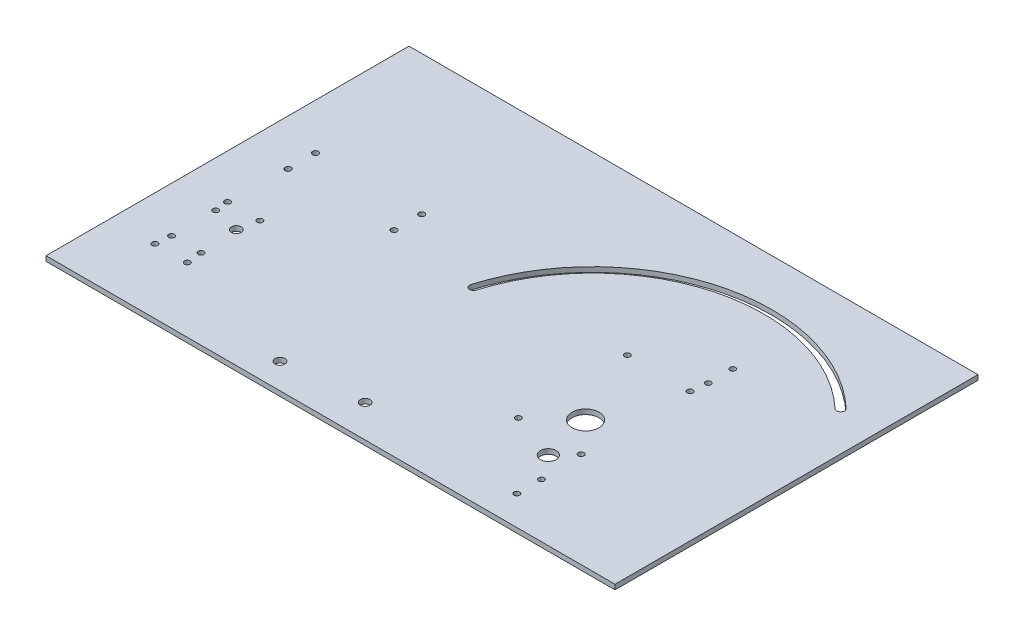
from build123d import *

# Parameters (mm, degrees)
SKETCH1_W           = 317.5
SKETCH1_H           = 177.8
SKETCH1_R           = 3.175
SKETCH1_R_2         = 8.73125
SKETCH1_R_3         = 1.905
BOSS_EXTRUDE1_DEPTH = 3.175
SKETCH3_R           = 3.175
CUT_EXTRUDE2_DEPTH  = 182.974869488
SKETCH4_W           = 25.4
SKETCH4_H           = 177.8
CUT_EXTRUDE3_DEPTH  = 182.974869488
SKETCH5_R           = 5.08
CUT_EXTRUDE4_DEPTH  = 182.974869488
SKETCH6_R           = 1.8034
CUT_EXTRUDE5_DEPTH  = 182.974869488
SKETCH7_R           = 1.8415
CUT_EXTRUDE6_DEPTH  = 182.974869488
BOSS_EXTRUDE2_DEPTH = 3.175
CUT_EXTRUDE7_DEPTH  = 256.444486386


with BuildPart() as part:
    # Sketch1 → Boss-Extrude1 (new body)
    with BuildSketch(Plane(origin=(0, 0, 0), x_dir=(1, 0, 0), z_dir=(0, 1, 0))):
        Rectangle(SKETCH1_W, SKETCH1_H)
        with Locations(Location((-111.76, -12.7, 0), (0, 0, 270))):
            Circle(SKETCH1_R, mode=Mode.SUBTRACT)
        with Locations(Location((107.95, -6.35, 0), (0, 0, 270))):
            Circle(SKETCH1_R_2, mode=Mode.SUBTRACT)
        with Locations(Location((-129.032, 55.88, 0), (0, 0, 270))):
            Circle(SKETCH1_R_3, mode=Mode.SUBTRACT)
        with Locations(Location((-60.452, 55.88, 0), (0, 0, 270))):
            Circle(SKETCH1_R_3, mode=Mode.SUBTRACT)
        with Locations(Location((-129.032, 38.1, 0), (0, 0, 270))):
            Circle(SKETCH1_R_3, mode=Mode.SUBTRACT)
        with Locations(Location((-60.452, 38.1, 0), (0, 0, 270))):
            Circle(SKETCH1_R_3, mode=Mode.SUBTRACT)
    extrude(amount=BOSS_EXTRUDE1_DEPTH)

    # Sketch3 → Cut-Extrude2 (cut, through all)
    with BuildSketch(Plane(origin=(0, 0, 0), x_dir=(-1, 0, 0), z_dir=(0, -1, 0))):
        with Locations(Location((23.829539609, -72.39, 0), (0, 0, 90))):
            Circle(SKETCH3_R)
        with Locations(Location((-26.764302072, -67.818, 0), (0, 0, 90))):
            Circle(SKETCH3_R)
    extrude(amount=-CUT_EXTRUDE2_DEPTH, mode=Mode.SUBTRACT)

    # Sketch4 → Cut-Extrude3 (cut, through all)
    with BuildSketch(Plane(origin=(0, 3.175, 0), x_dir=(1, 0, 0), z_dir=(0, 1, 0))):
        with Locations((146.05, 0)):
            Rectangle(SKETCH4_W, SKETCH4_H)
    extrude(amount=-CUT_EXTRUDE3_DEPTH, mode=Mode.SUBTRACT)

    # Sketch5 → Cut-Extrude4 (cut, through all)
    with BuildSketch(Plane(origin=(0, 3.175, 0), x_dir=(1, 0, 0), z_dir=(0, 1, 0))):
        with Locations(Location((115.57, -38.1, 0), (0, 0, 270))):
            Circle(SKETCH5_R)
    extrude(amount=-CUT_EXTRUDE4_DEPTH, mode=Mode.SUBTRACT)

    # Sketch6 → Cut-Extrude5 (cut, through all)
    with BuildSketch(Plane.XZ):
        with Locations(Location((127, 69.85, 0), (0, 0, 270))):
            Circle(SKETCH6_R)
        with Locations(Location((127, 53.975, 0), (0, 0, 270))):
            Circle(SKETCH6_R)
        with Locations(Location((127, -53.975, 0), (0, 0, 270))):
            Circle(SKETCH6_R)
        with Locations(Location((127, -69.85, 0), (0, 0, 270))):
            Circle(SKETCH6_R)
    extrude(amount=-CUT_EXTRUDE5_DEPTH, mode=Mode.SUBTRACT)

    # Sketch7 → Cut-Extrude6 (cut, through all)
    with BuildSketch(Plane(origin=(0, 3.175, 0), x_dir=(1, 0, 0), z_dir=(0, 1, 0))):
        with Locations(Location((125.73, 43.4975, 0), (0, 0, 270))):
            Circle(SKETCH7_R)
        with Locations(Location((85.09, 43.4975, 0), (0, 0, 270))):
            Circle(SKETCH7_R)
        with Locations(Location((85.09, -26.9875, 0), (0, 0, 270))):
            Circle(SKETCH7_R)
        with Locations(Location((125.73, -26.9875, 0), (0, 0, 270))):
            Circle(SKETCH7_R)
        with Locations(Location((-130.175, -46.99, 0), (0, 0, 270))):
            Circle(SKETCH7_R)
        with Locations(Location((-109.22, -46.99, 0), (0, 0, 270))):
            Circle(SKETCH7_R)
        with Locations(Location((-129.2225, -37.1475, 0), (0, 0, 270))):
            Circle(SKETCH7_R)
        with Locations(Location((-110.1725, -37.1475, 0), (0, 0, 270))):
            Circle(SKETCH7_R)
        with Locations(Location((-129.2225, -8.5725, 0), (0, 0, 270))):
            Circle(SKETCH7_R)
        with Locations(Location((-130.175, 0, 0), (0, 0, 270))):
            Circle(SKETCH7_R)
        with Locations(Location((-109.22, 0, 0), (0, 0, 270))):
            Circle(SKETCH7_R)
    extrude(amount=-CUT_EXTRUDE6_DEPTH, mode=Mode.SUBTRACT)

    # Sketch8 → Boss-Extrude2 (add, through all)
    with BuildSketch(Plane.XZ):
        Polygon((133.35, 88.9), (133.35, -88.9), (-158.75, -88.9), (-158.75, -146.05), (209.55, -146.05), (209.55, 88.9), align=None)
    extrude(amount=-BOSS_EXTRUDE2_DEPTH)

    # Sketch9 → Cut-Extrude7 (cut, through all)
    with BuildSketch(Plane.XZ):
        with BuildLine():
            ThreePointArc((185.887196571, -84.403037526), (186.003037526, -80.812803429), (182.412803429, -80.696962474))
            ThreePointArc((182.412803429, -80.696962474), (77.245012608, -106.855963541), (-0.184362161, -31.032158005))
            ThreePointArc((-0.184362161, -31.032158005), (-3.338657084, -29.313547072), (-5.057268017, -32.467841995))
            ThreePointArc((-5.057268017, -32.467841995), (75.911735313, -111.757878642), (185.887196571, -84.403037526))
        make_face()
    extrude(amount=-CUT_EXTRUDE7_DEPTH, mode=Mode.SUBTRACT)


solid = part.part
